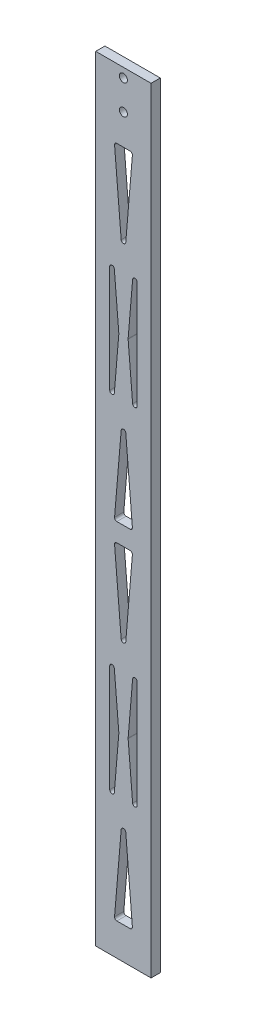
from build123d import *

# Parameters (mm, degrees)
SKETCH1_W           = 38.1
SKETCH1_H           = 533.4
BOSS_EXTRUDE1_DEPTH = 3.175
SKETCH2_R           = 2.778125
CUT_EXTRUDE1_DEPTH  = 294.271022264
CUT_EXTRUDE2_DEPTH  = 294.271022264
FILLET1_R           = 1.5875


with BuildPart() as part:
    # Sketch1 → Boss-Extrude1 (new, symmetric)
    with BuildSketch(Plane.XY):
        with Locations((-6.35, -25.4)):
            Rectangle(SKETCH1_W, SKETCH1_H)
    extrude(amount=BOSS_EXTRUDE1_DEPTH, both=True)

    # Sketch2 → Cut-Extrude1 (cut, through all)
    with BuildSketch(Plane.XY.offset(3.175)):
        with Locations((-6.35, 234.95)):
            Circle(SKETCH2_R)
        with Locations((-6.35, 214.63)):
            Circle(SKETCH2_R)
    extrude(amount=-CUT_EXTRUDE1_DEPTH, mode=Mode.SUBTRACT)

    # Sketch3 → Cut-Extrude2 (cut, through all)
    with BuildSketch(Plane.XY.offset(3.175)):
        Polygon((-6.291879002, 118.898888525), (-0.011179953, 193.675), (-12.57257805, 193.675), align=None)
        Polygon((3.175, 6.189078026), (3.175, 155.741300976), (-3.105699049, 80.965189501), align=None)
        Polygon((-15.758758004, 6.189078026), (-9.478058955, 80.965189501), (-15.758758004, 155.741300976), align=None)
        Polygon((-0.011179953, -31.744620998), (-6.291879002, 43.031490477), (-12.57257805, -31.744620998), align=None)
        Polygon((-6.291879002, -119.220732473), (-0.011179953, -44.444620998), (-12.57257805, -44.444620998), align=None)
        Polygon((3.175, -231.930542972), (3.175, -82.378320022), (-3.105699049, -157.154431497), align=None)
        Polygon((-9.478058955, -157.154431497), (-15.758758004, -82.378320022), (-15.758758004, -231.930542972), align=None)
        Polygon((-0.011179953, -269.864241996), (-6.291879002, -195.088130521), (-12.57257805, -269.864241996), align=None)
    extrude(amount=-CUT_EXTRUDE2_DEPTH, mode=Mode.SUBTRACT)

    # Fillet1
    fillet1_edges = [part.edges().sort_by_distance(p)[0] for p in [
        (-6.291879002, -119.220732473, 0),
        (-12.57257805, -44.444620998, 0),
        (-0.011179953, -44.444620998, 0),
        (-6.291879002, 43.031490477, 0),
        (-0.011179953, -31.744620998, 0),
        (-12.57257805, -31.744620998, 0),
        (-15.758758004, 155.741300976, 0),
        (-9.478058955, 80.965189501, 0),
        (-15.758758004, 6.189078026, 0),
        (-3.105699049, 80.965189501, 0),
        (3.175, 155.741300976, 0),
        (3.175, 6.189078026, 0),
        (-12.57257805, -269.864241996, 0),
        (-6.291879002, -195.088130521, 0),
        (-0.011179953, -269.864241996, 0),
        (-15.758758004, -231.930542972, 0),
        (-15.758758004, -82.378320022, 0),
        (-9.478058955, -157.154431497, 0),
        (-3.105699049, -157.154431497, 0),
        (3.175, -82.378320022, 0),
        (3.175, -231.930542972, 0),
        (-12.57257805, 193.675, 0),
        (-0.011179953, 193.675, 0),
        (-6.291879002, 118.898888525, 0),
    ]]
    fillet(fillet1_edges, radius=FILLET1_R)


solid = part.part
